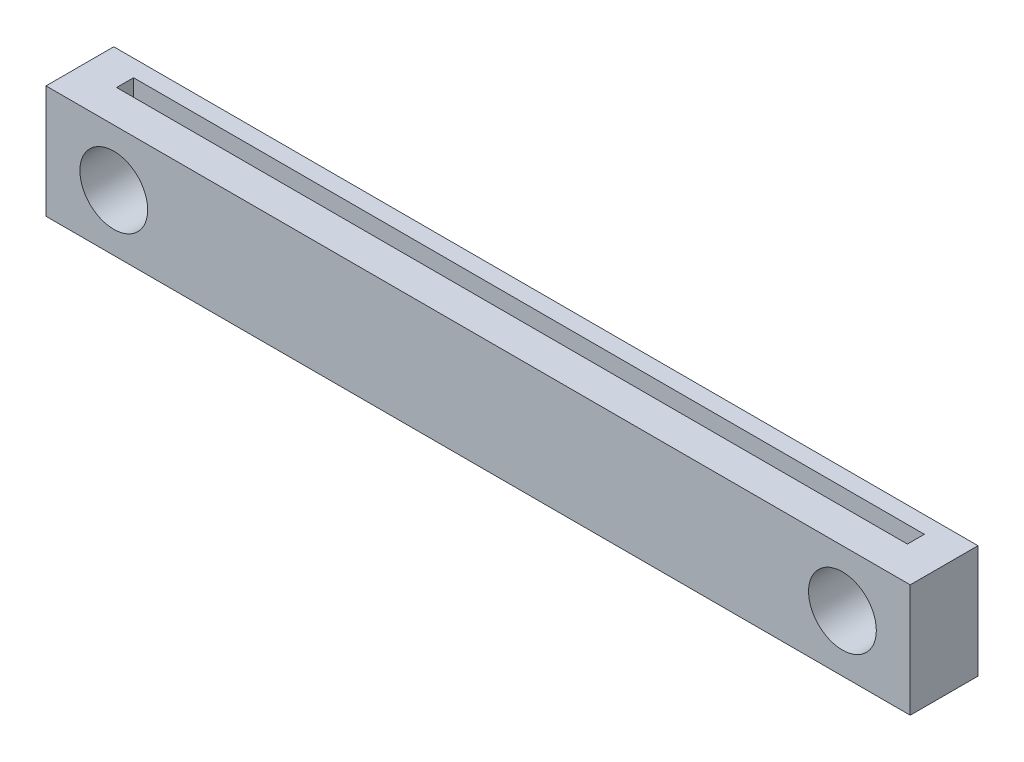
from build123d import *

# Parameters (mm, degrees)
SKETCH_1_W          = 70
SKETCH_1_H          = 10
EXTRUDE_1_DEPTH     = 6
SKETCH_2_W          = 1.5
SKETCH_2_H          = 1.5
CUT_EXTRUDE_1_DEPTH = 71.434366612
SKETCH_3_R          = 3
CUT_EXTRUDE_2_DEPTH = 36.860842154
SKETCH_4_R          = 3
CUT_EXTRUDE_3_DEPTH = 36.860842154
SKETCH_5_W          = 3.25
SKETCH_5_H          = 10
EXTRUDE_2_DEPTH     = 6
SKETCH_9_R          = 3
CUT_EXTRUDE_4_DEPTH = 40.039243077
SKETCH_10_R         = 3
EXTRUDE_4_DEPTH     = 6
SKETCH_11_R         = 3
CUT_EXTRUDE_5_DEPTH = 40.039243077


with BuildPart() as part:
    # 草图1 → 凸台-拉伸1 (new body)
    with BuildSketch(Plane.XY):
        Rectangle(SKETCH_1_W, SKETCH_1_H)
    extrude(amount=EXTRUDE_1_DEPTH)

    # 草图2 → 切除-拉伸1 (cut, through all)
    with BuildSketch(Plane.ZY.offset(35)):
        with Locations((2.25, 4.25)):
            Rectangle(SKETCH_2_W, SKETCH_2_H)
        with Locations((2.25, -4.25)):
            Rectangle(SKETCH_2_W, SKETCH_2_H)
    extrude(amount=-CUT_EXTRUDE_1_DEPTH, mode=Mode.SUBTRACT)

    # 草图3 → 切除-拉伸2 (cut, through all)
    with BuildSketch(Plane.XY.offset(6)):
        with Locations((-29, 0)):
            Circle(SKETCH_3_R)
        with Locations((29, 0)):
            Circle(SKETCH_3_R)
    extrude(amount=-CUT_EXTRUDE_2_DEPTH, mode=Mode.SUBTRACT)

    # 草图4 → 切除-拉伸3 (cut, through all)
    with BuildSketch(Plane.XY.offset(6)):
        with Locations((-32.25, 0)):
            Circle(SKETCH_4_R)
    extrude(amount=-CUT_EXTRUDE_3_DEPTH, mode=Mode.SUBTRACT)

    # 草图5 → 凸台-拉伸2 (add)
    with BuildSketch(Plane.XY.offset(6)):
        with Locations((36.625, 0)):
            Rectangle(SKETCH_5_W, SKETCH_5_H)
        with Locations((-36.625, 0)):
            Rectangle(SKETCH_5_W, SKETCH_5_H)
    extrude(amount=-EXTRUDE_2_DEPTH)

    # 草图9 → 切除-拉伸4 (cut, through all)
    with BuildSketch(Plane.XY.offset(6)):
        with BuildLine():
            ThreePointArc((-30.625, -2.521780125), (-32, 0), (-30.625, 2.521780125))
            ThreePointArc((-30.625, 2.521780125), (-33.118257406, 2.871607403), (-35, 1.198957881))
            Line((-35, 1.198957881), (-35, -1.198957881))
            ThreePointArc((-35, -1.198957881), (-33.118257406, -2.871607403), (-30.625, -2.521780125))
        make_face()
        with BuildLine():
            Line((-35, -1.198957881), (-35, 1.198957881))
            ThreePointArc((-35, 1.198957881), (-35.25, 0), (-35, -1.198957881))
        make_face()
        with Locations((-29, 0)):
            Circle(SKETCH_9_R)
        with Locations((-32.25, 0)):
            Circle(SKETCH_9_R)
        with Locations((32.25, 0)):
            Circle(SKETCH_9_R)
        with Locations((29, 0)):
            Circle(SKETCH_9_R)
    extrude(amount=-CUT_EXTRUDE_4_DEPTH, mode=Mode.SUBTRACT)

    # 草图10 → 凸台-拉伸4 (add)
    with BuildSketch(Plane.XY.offset(6)):
        with Locations((-29, 0)):
            Circle(SKETCH_10_R)
        with Locations((29, 0)):
            Circle(SKETCH_10_R)
    extrude(amount=-EXTRUDE_4_DEPTH)

    # 草图11 → 切除-拉伸5 (cut, through all)
    with BuildSketch(Plane.XY.offset(6)):
        with Locations((-32.25, 0)):
            Circle(SKETCH_11_R)
        with Locations((32.25, 0)):
            Circle(SKETCH_11_R)
    extrude(amount=-CUT_EXTRUDE_5_DEPTH, mode=Mode.SUBTRACT)


solid = part.part
